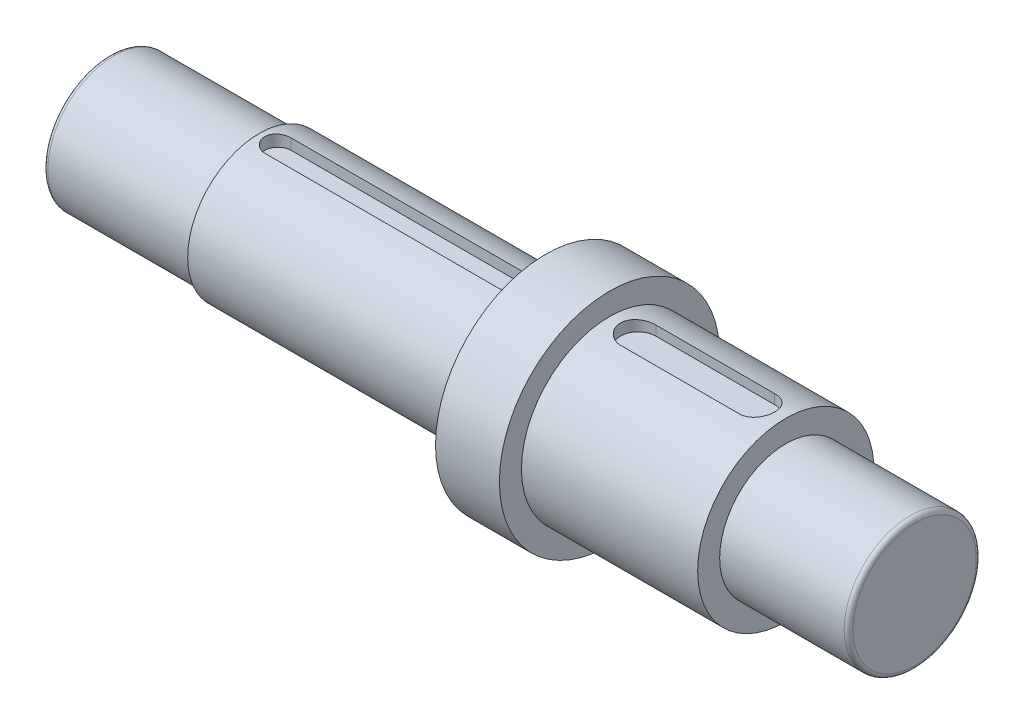
from build123d import *

# Parameters (mm, degrees)
FILLET1_R          = 2
CUT_EXTRUDE1_DEPTH = 5.44
CUT_EXTRUDE2_DEPTH = 5.19


with BuildPart() as part:
    # Sketch1 → Revolve1 (revolve)
    with BuildSketch(Plane.XY, mode=Mode.PRIVATE) as revolve1_sk:
        Polygon((-188.099626112, 0), (-188.099626112, 30), (-120.099626112, 30), (-120.099626112, 32.5), (9.900373888, 32.5), (9.900373888, 50), (38.900373888, 50), (38.900373888, 40), (118.900373888, 40), (118.900373888, 30), (177.400373888, 30), (177.400373888, 0), align=None)
    revolve(revolve1_sk.sketch.rotate(Axis((-188.099626112, 0, 0), (1, 0, 0)), 90), axis=Axis((-188.099626112, 0, 0), (1, 0, 0)))

    # Fillet1
    fillet1_edges = [part.edges().sort_by_distance(p)[0] for p in [
        (-188.099626112, 0, -30),
        (177.400373888, 0, -30),
    ]]
    fillet(fillet1_edges, radius=FILLET1_R)

    # Sketch2 → Cut-Extrude1 (cut)
    with BuildSketch(Plane(origin=(0, 32.5, 0), x_dir=(1, 0, 0), z_dir=(0, 1, 0))):
        with BuildLine():
            Line((-111.599626112, 6), (1.400373888, 6))
            ThreePointArc((1.400373888, 6), (7.400373888, 0), (1.400373888, -6))
            Line((1.400373888, -6), (-111.599626112, -6))
            ThreePointArc((-111.599626112, -6), (-117.599626112, 0), (-111.599626112, 6))
        make_face()
    extrude(amount=-CUT_EXTRUDE1_DEPTH, mode=Mode.SUBTRACT)

    # Sketch3 → Cut-Extrude2 (cut)
    with BuildSketch(Plane(origin=(0, 40, 0), x_dir=(1, 0, 0), z_dir=(0, 1, 0))):
        with BuildLine():
            Line((51.900373888, 8), (105.900373888, 8))
            ThreePointArc((105.900373888, 8), (113.900373888, 0), (105.900373888, -8))
            Line((105.900373888, -8), (51.900373888, -8))
            ThreePointArc((51.900373888, -8), (43.900373888, 0), (51.900373888, 8))
        make_face()
    extrude(amount=-CUT_EXTRUDE2_DEPTH, mode=Mode.SUBTRACT)


solid = part.part
